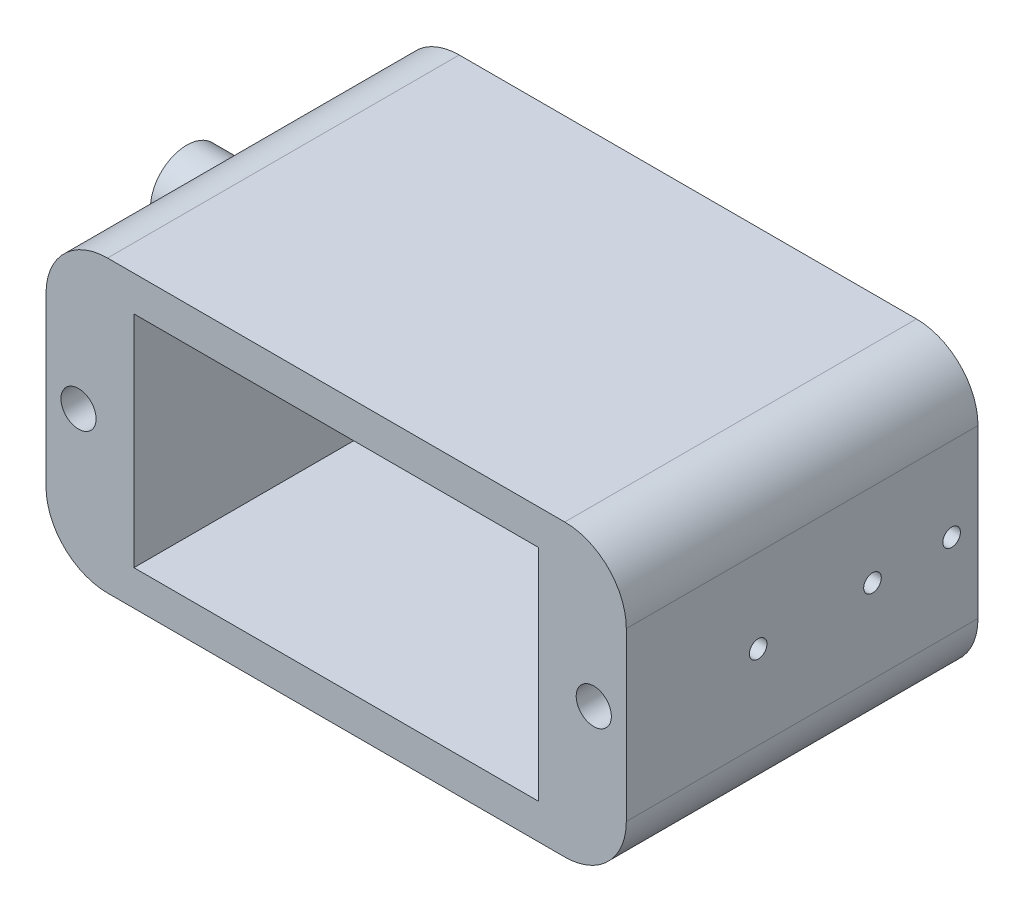
from build123d import *

# Parameters (mm, degrees)
SKETCH1_W           = 33
SKETCH1_H           = 16.5
SKETCH1_W_2         = 23
SKETCH1_H_2         = 12.5
BOSS_EXTRUDE1_DEPTH = 16
SKETCH2_R           = 1
CUT_EXTRUDE1_DEPTH  = 4
SKETCH6_R           = 4.575
BOSS_EXTRUDE5_DEPTH = 4
SKETCH7_W           = 3
SKETCH7_H           = 10
CUT_EXTRUDE3_DEPTH  = 11
SKETCH9_R           = 0.5
CUT_EXTRUDE4_DEPTH  = 4
SKETCH10_R          = 2.06
BOSS_EXTRUDE6_DEPTH = 6
FILLET1_R           = 3.5


with BuildPart() as part:
    # Sketch1 → Boss-Extrude1 (new body)
    with BuildSketch(Plane.XY):
        Rectangle(SKETCH1_W, SKETCH1_H)
        Rectangle(SKETCH1_W_2, SKETCH1_H_2, mode=Mode.SUBTRACT)
    extrude(amount=BOSS_EXTRUDE1_DEPTH)

    # Sketch2 → Cut-Extrude1 (cut)
    with BuildSketch(Plane.XY.offset(16)):
        with Locations((-14.65, 0)):
            Circle(SKETCH2_R)
        with Locations(Location((14.65, 0, 0), (0, 0, 180))):
            Circle(SKETCH2_R)
    extrude(amount=-CUT_EXTRUDE1_DEPTH, mode=Mode.SUBTRACT)

    # Sketch6 → Boss-Extrude5 (add)
    with BuildSketch(Plane(origin=(0, 0, 0), x_dir=(-1, 0, 0), z_dir=(0, 0, -1))):
        Polygon((-11.5, 8.25), (16.5, 8.25), (16.5, -8.25), (-11.5, -8.25), (-16.5, -8.25), (-16.5, 8.25), align=None)
        with Locations((-5.175, 0)):
            Circle(SKETCH6_R, mode=Mode.SUBTRACT)
    extrude(amount=BOSS_EXTRUDE5_DEPTH)

    # Sketch7 → Cut-Extrude3 (cut)
    with BuildSketch(Plane(origin=(0, 0, -4), x_dir=(-1, 0, 0), z_dir=(0, 0, -1))):
        with Locations((-13, 0)):
            Rectangle(SKETCH7_W, SKETCH7_H)
    extrude(amount=-CUT_EXTRUDE3_DEPTH, mode=Mode.SUBTRACT)

    # Sketch9 → Cut-Extrude4 (cut)
    with BuildSketch(Plane(origin=(16.5, 0, 0), x_dir=(0, 0, -1), z_dir=(1, 0, 0))):
        with Locations((-2, 0)):
            Circle(SKETCH9_R)
        with Locations((2.5, 0)):
            Circle(SKETCH9_R)
        with Locations((-8.5, 0)):
            Circle(SKETCH9_R)
    extrude(amount=-CUT_EXTRUDE4_DEPTH, mode=Mode.SUBTRACT)

    # Sketch10 → Boss-Extrude6 (add)
    with BuildSketch(Plane.ZY.offset(16.5)):
        with Locations(Location((2, 0, 0), (0, 0, 180))):
            Circle(SKETCH10_R)
    extrude(amount=BOSS_EXTRUDE6_DEPTH)

    # Fillet1
    fillet1_edges = [part.edges().sort_by_distance(p)[0] for p in [
        (16.5, -8.25, 6),
        (-16.5, -8.25, 6),
        (-16.5, 8.25, 6),
        (16.5, 8.25, 6),
    ]]
    fillet(fillet1_edges, radius=FILLET1_R)


solid = part.part
